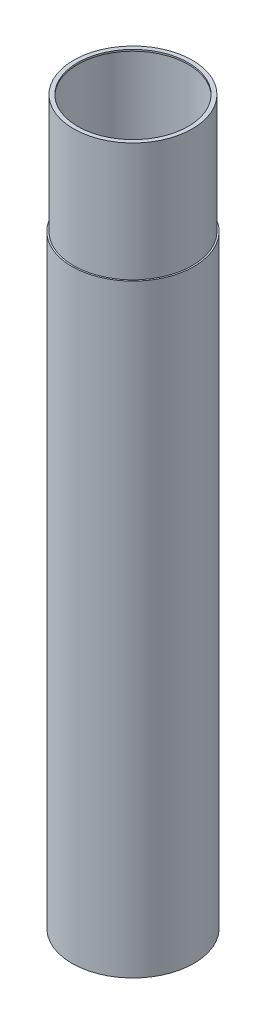
from build123d import *

# Parameters (mm, degrees)
SKETCH1_W                = 1.96
SKETCH1_H                = 774
BOSS_EXTRUDE1_DEPTH      = 152
BOSS_EXTRUDE1_DEPTH_BACK = 152
SKETCH3_R                = 76.2
SKETCH3_R_2              = 75.2
BOSS_EXTRUDE2_START      = -2
SKETCH4_R                = 76.2
SKETCH4_R_2              = 70.915017824
BOSS_EXTRUDE2_DEPTH      = 2


with BuildPart() as part:
    # Sketch1 → Revolve1 (revolve)
    with BuildSketch(Plane.XY, mode=Mode.PRIVATE) as revolve1_sk:
        with Locations((77.18, 387)):
            Rectangle(SKETCH1_W, SKETCH1_H)
    revolve(revolve1_sk.sketch.rotate(Axis((0, 204.615384615, 0), (0, -1, 0)), 90), axis=Axis((0, 204.615384615, 0), (0, -1, 0)))

    # Sketch3 → Boss-Extrude1 (add, two sides: drawn at the far end of the back side and taken through both)
    with BuildSketch(Plane(origin=(0, 774, 0), x_dir=(1, 0, 0), z_dir=(0, 1, 0)).offset(-BOSS_EXTRUDE1_DEPTH_BACK)):
        with Locations(Location((0, 0, 0), (0, 0, 270))):
            Circle(SKETCH3_R)
        with Locations(Location((0, 0, 0), (0, 0, 270))):
            Circle(SKETCH3_R_2, mode=Mode.SUBTRACT)
    extrude(amount=BOSS_EXTRUDE1_DEPTH + BOSS_EXTRUDE1_DEPTH_BACK)

    # Sketch4 → Boss-Extrude2 (add)
    with BuildSketch(Plane(origin=(0, 926, 0), x_dir=(1, 0, 0), z_dir=(0, 1, 0)).offset(BOSS_EXTRUDE2_START)):
        with Locations(Location((0, 0, 0), (0, 0, 270))):
            Circle(SKETCH4_R)
        with Locations(Location((0, 0, 0), (0, 0, 270))):
            Circle(SKETCH4_R_2, mode=Mode.SUBTRACT)
    extrude(amount=BOSS_EXTRUDE2_DEPTH)


solid = part.part
